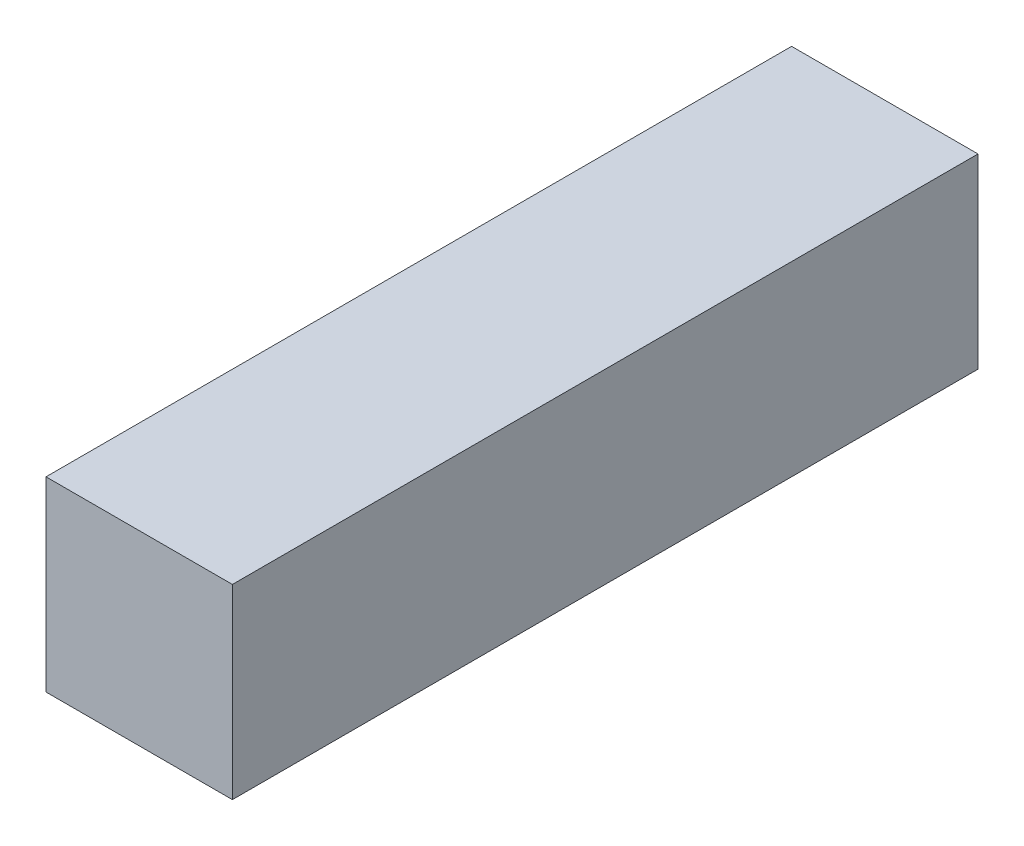
from build123d import *

# Parameters (mm, degrees)
SKETCH_1_W      = 5.5
SKETCH_1_H      = 5.5
EXTRUDE_1_DEPTH = 22


with BuildPart() as part:
    # ｽｹｯﾁ1 → ﾎﾞｽ - 押し出し1 (new body)
    with BuildSketch(Plane.XY):
        Rectangle(SKETCH_1_W, SKETCH_1_H)
    extrude(amount=EXTRUDE_1_DEPTH)


solid = part.part
